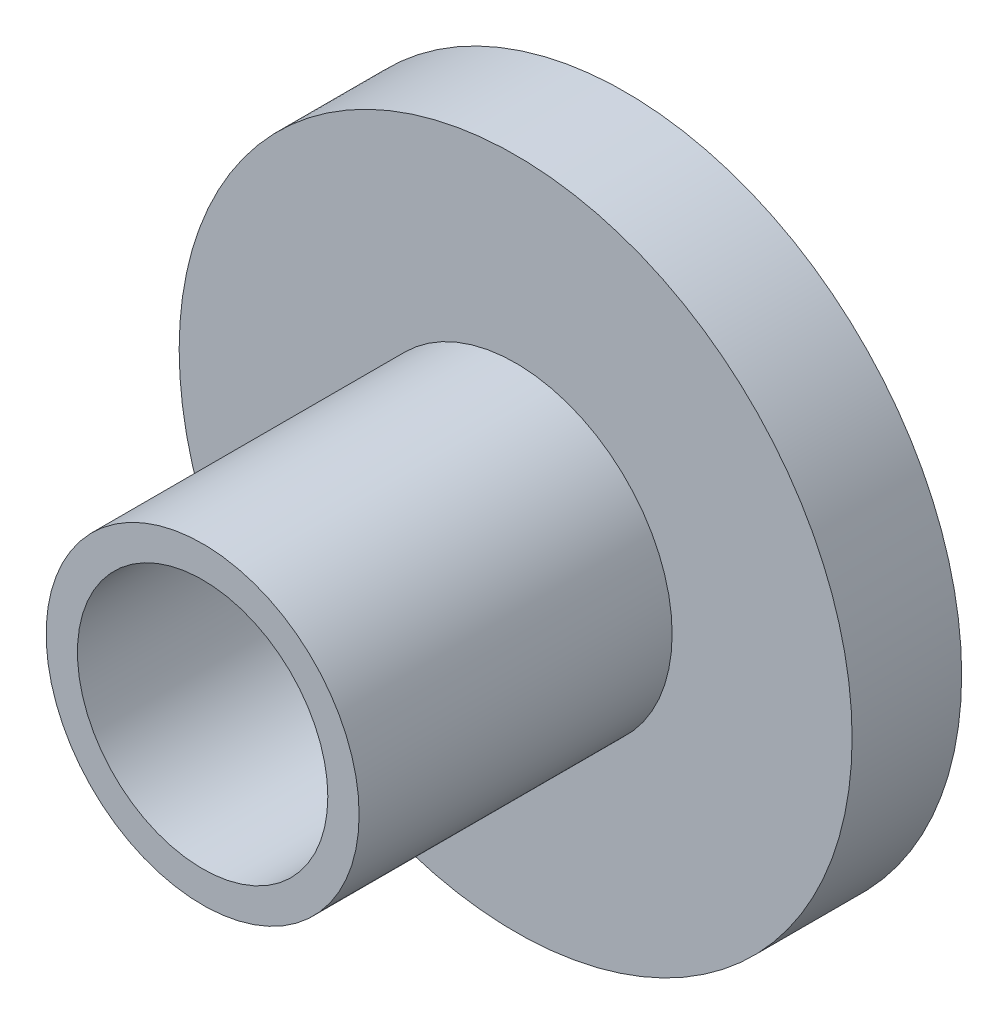
from build123d import *

# Parameters (mm, degrees)
SKETCH1_R           = 10.75
BOSS_EXTRUDE1_DEPTH = 3.5
SKETCH2_R           = 5
BOSS_EXTRUDE2_DEPTH = 10
CUT_EXTRUDE1_REACH  = 22.332
SKETCH3_R           = 4


with BuildPart() as part:
    # Sketch1 → Boss-Extrude1 (new body)
    with BuildSketch(Plane.XY):
        Circle(SKETCH1_R)
    extrude(amount=BOSS_EXTRUDE1_DEPTH)

    # Sketch2 → Boss-Extrude2 (add)
    with BuildSketch(Plane.XY.offset(3.5)):
        Circle(SKETCH2_R)
    extrude(amount=BOSS_EXTRUDE2_DEPTH)

    # Sketch3 → Cut-Extrude1 (cut, up to next)
    with BuildSketch(Plane.XY.offset(13.5), mode=Mode.PRIVATE) as cut_extrude1_sk1:
        Circle(SKETCH3_R)
    cut_extrude1_tool1 = extrude(cut_extrude1_sk1.sketch, amount=-CUT_EXTRUDE1_REACH, mode=Mode.PRIVATE) & part.part
    add(cut_extrude1_tool1.solids().sort_by_distance((0, 0, 13.5))[0], mode=Mode.SUBTRACT)


solid = part.part
